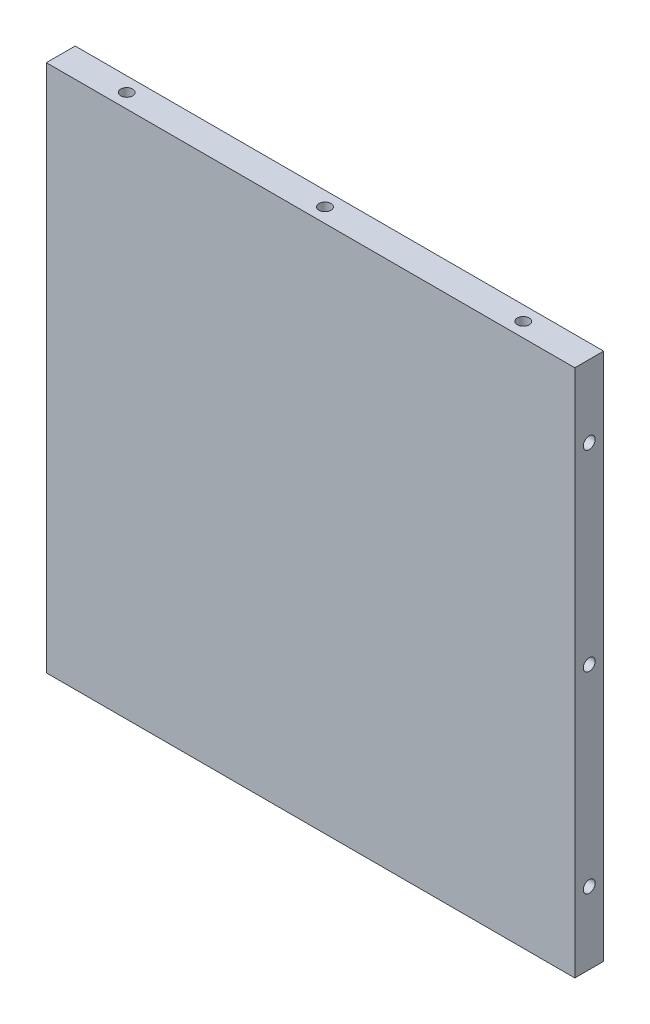
from build123d import *

# Parameters (mm, degrees)
SKETCH_1_W          = 146.6
SKETCH_1_H          = 146.6
EXTRUDE_1_DEPTH     = 8
SKETCH_2_R          = 1.65
CUT_EXTRUDE_1_DEPTH = 208.477998834
SKETCH_3_R          = 1.65
CUT_EXTRUDE_2_DEPTH = 208.477998834
EXTRUDE_2_REACH     = 209.478
SKETCH_4_W          = 116.6
SKETCH_4_H          = 116.6


with BuildPart() as part:
    # Эскиз1 → Бобышка-Вытянуть1 (new body)
    with BuildSketch(Plane.XY):
        with Locations((73.3, 73.3)):
            Rectangle(SKETCH_1_W, SKETCH_1_H)
    extrude(amount=EXTRUDE_1_DEPTH)

    # Эскиз2 → Вырез-Вытянуть1 (cut, through all)
    with BuildSketch(Plane.XZ):
        with Locations(Location((18.3, 4, 0), (0, 0, 270))):
            Circle(SKETCH_2_R)
        with Locations(Location((73.3, 4, 0), (0, 0, 270))):
            Circle(SKETCH_2_R)
        with Locations(Location((128.3, 4, 0), (0, 0, 270))):
            Circle(SKETCH_2_R)
    extrude(amount=-CUT_EXTRUDE_1_DEPTH, mode=Mode.SUBTRACT)

    # Эскиз3 → Вырез-Вытянуть2 (cut, through all)
    with BuildSketch(Plane.ZY):
        with Locations(Location((4, 20, 0), (0, 0, 270))):
            Circle(SKETCH_3_R)
        with Locations(Location((4, 73.3, 0), (0, 0, 270))):
            Circle(SKETCH_3_R)
        with Locations(Location((4, 126.6, 0), (0, 0, 270))):
            Circle(SKETCH_3_R)
    extrude(amount=-CUT_EXTRUDE_2_DEPTH, mode=Mode.SUBTRACT)

    # Бобышка-Вытянуть2: up to this face of the body (flat: up to its plane)
    extrude_2_end = Plane(part.part.faces().sort_by_distance((73.3, 73.3, 0))[0])
    # Эскиз4 → Бобышка-Вытянуть2 (add, up to the picked face)
    with BuildSketch(Plane.XY.offset(8), mode=Mode.PRIVATE) as extrude_2_sk1:
        with Locations((73.3, 73.3)):
            Rectangle(SKETCH_4_W, SKETCH_4_H)
    extrude_2_tool1 = split(extrude(extrude_2_sk1.sketch, amount=-EXTRUDE_2_REACH, mode=Mode.PRIVATE), bisect_by=extrude_2_end, keep=Keep.BOTH, mode=Mode.PRIVATE)
    add(extrude_2_tool1.solids().sort_by(Axis((73.3, 73.3, 8), (0, 0, -1)))[0])


solid = part.part
